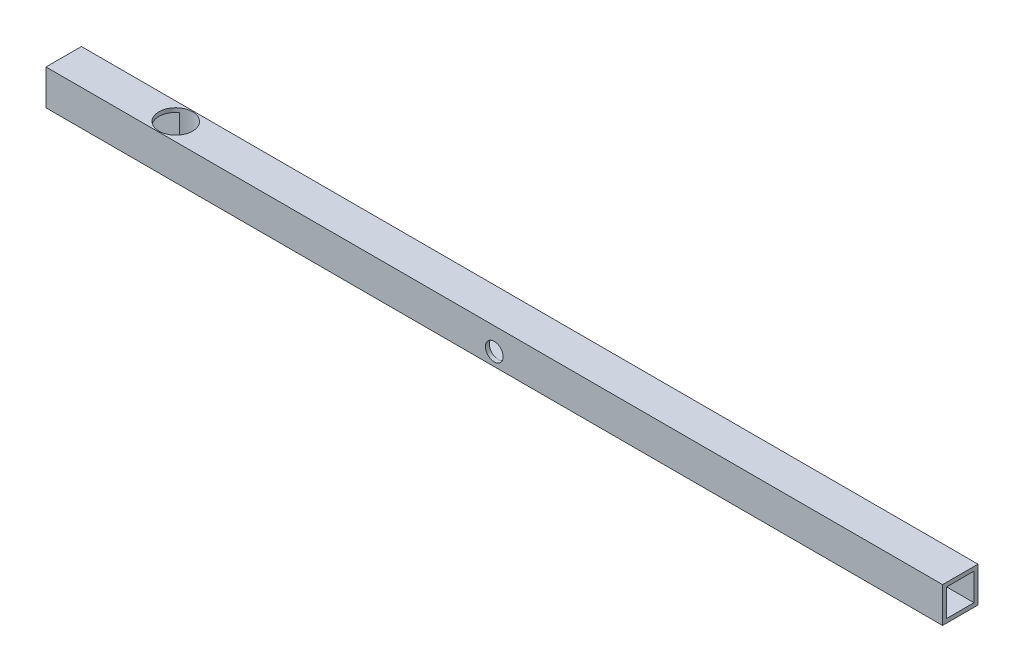
from build123d import *

# Parameters (mm, degrees)
SKETCH1_W           = 3.16
SKETCH1_H           = 3.16
SKETCH1_W_2         = 2.44
SKETCH1_H_2         = 2.44
BOSS_EXTRUDE1_DEPTH = 80
SKETCH2_R           = 0.79375
CUT_EXTRUDE1_DEPTH  = 81.124722776
SKETCH3_R           = 1.5
CUT_EXTRUDE2_DEPTH  = 81.124722776


with BuildPart() as part:
    # Sketch1 → Boss-Extrude1 (new body)
    with BuildSketch(Plane(origin=(0, 0, 0), x_dir=(0, 0, -1), z_dir=(1, 0, 0))):
        with Locations((1.58, 1.58)):
            Rectangle(SKETCH1_W, SKETCH1_H)
        with Locations((1.58, 1.58)):
            Rectangle(SKETCH1_W_2, SKETCH1_H_2, mode=Mode.SUBTRACT)
    extrude(amount=BOSS_EXTRUDE1_DEPTH)

    # Sketch2 → Cut-Extrude1 (cut, through all)
    with BuildSketch(Plane.XY):
        with Locations((40, 1.16)):
            Circle(SKETCH2_R)
    extrude(amount=-CUT_EXTRUDE1_DEPTH, mode=Mode.SUBTRACT)

    # Sketch3 → Cut-Extrude2 (cut, through all)
    with BuildSketch(Plane(origin=(0, 3.16, 0), x_dir=(1, 0, 0), z_dir=(0, 1, 0))):
        with Locations(Location((10, 1.58, 0), (0, 0, 270))):
            Circle(SKETCH3_R)
    extrude(amount=-CUT_EXTRUDE2_DEPTH, mode=Mode.SUBTRACT)


solid = part.part
